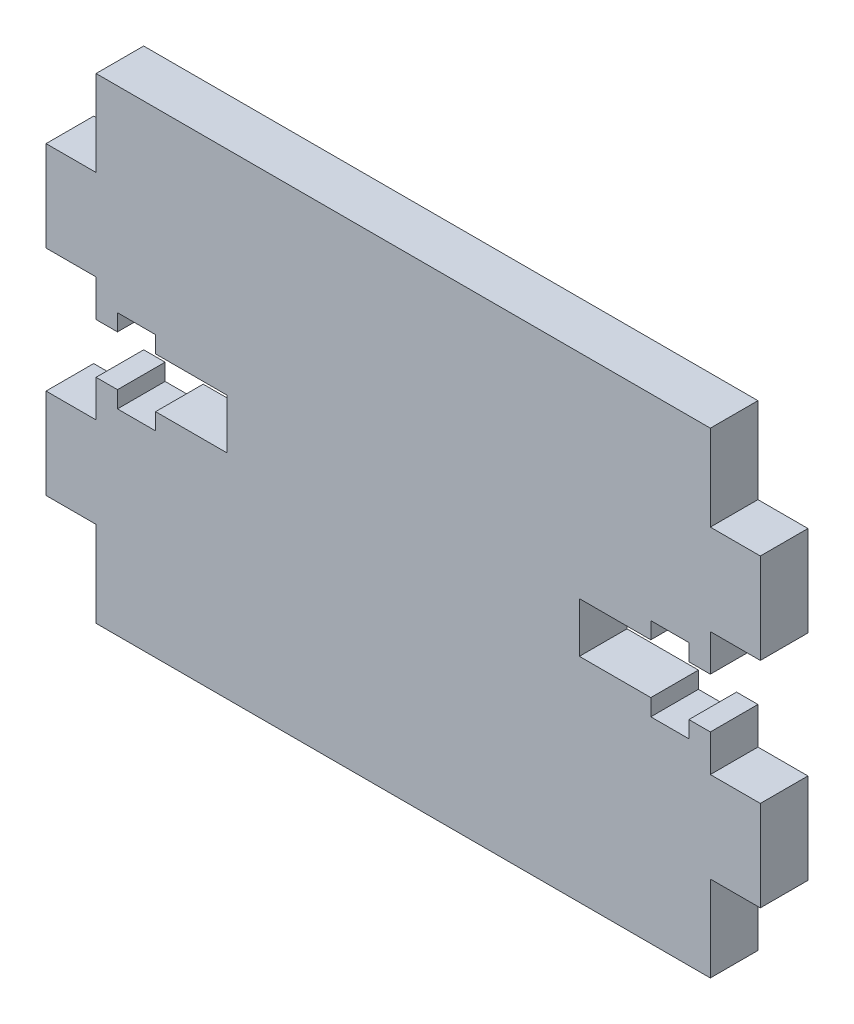
from build123d import *

# Parameters (mm, degrees)
ESQUISSE1_W             = 60
ESQUISSE1_H             = 40
BOSS_EXTRU_1_DEPTH      = 4
ESQUISSE2_W             = 4.4
ESQUISSE2_H             = 7.4
ESQUISSE2_H_2           = 10.4
ENL_V_MAT_EXTRU_1_DEPTH = 37.276714294
ENL_V_MAT_EXTRU_2_DEPTH = 37.276714294


with BuildPart() as part:
    # Esquisse1 → Boss.-Extru.1 (new body)
    with BuildSketch(Plane.XY):
        Rectangle(ESQUISSE1_W, ESQUISSE1_H)
    extrude(amount=BOSS_EXTRU_1_DEPTH)

    # Esquisse2 → Enlèv. mat.-Extru.1 (cut, through all)
    with BuildSketch(Plane(origin=(0, 0, 0), x_dir=(-1, 0, 0), z_dir=(0, 0, -1))):
        with Locations((-28, -16.5)):
            Rectangle(ESQUISSE2_W, ESQUISSE2_H)
        with Locations((-28, 16.5)):
            Rectangle(ESQUISSE2_W, ESQUISSE2_H)
        with Locations((-28, 0)):
            Rectangle(ESQUISSE2_W, ESQUISSE2_H_2)
        with Locations((28, 0)):
            Rectangle(ESQUISSE2_W, ESQUISSE2_H_2)
        with Locations((28, 16.5)):
            Rectangle(ESQUISSE2_W, ESQUISSE2_H)
        with Locations((28, -16.5)):
            Rectangle(ESQUISSE2_W, ESQUISSE2_H)
    extrude(amount=-ENL_V_MAT_EXTRU_1_DEPTH, mode=Mode.SUBTRACT)

    # Esquisse3 → Enlèv. mat.-Extru.2 (cut, through all)
    with BuildSketch(Plane(origin=(0, 0, 0), x_dir=(-1, 0, 0), z_dir=(0, 0, -1))):
        Polygon((-25.8, -2.1), (-25.8, 2.1), (-24, 2.1), (-24, 3.5), (-20.8, 3.5), (-20.8, 2.1), (-14.8, 2.1), (-14.8, -2.1), (-20.8, -2.1), (-20.8, -3.5), (-24, -3.5), (-24, -2.1), align=None)
        Polygon((25.8, -2.1), (24, -2.1), (24, -3.5), (20.8, -3.5), (20.8, -2.1), (14.8, -2.1), (14.8, 2.1), (20.8, 2.1), (20.8, 3.5), (24, 3.5), (24, 2.1), (25.8, 2.1), align=None)
    extrude(amount=-ENL_V_MAT_EXTRU_2_DEPTH, mode=Mode.SUBTRACT)


solid = part.part
